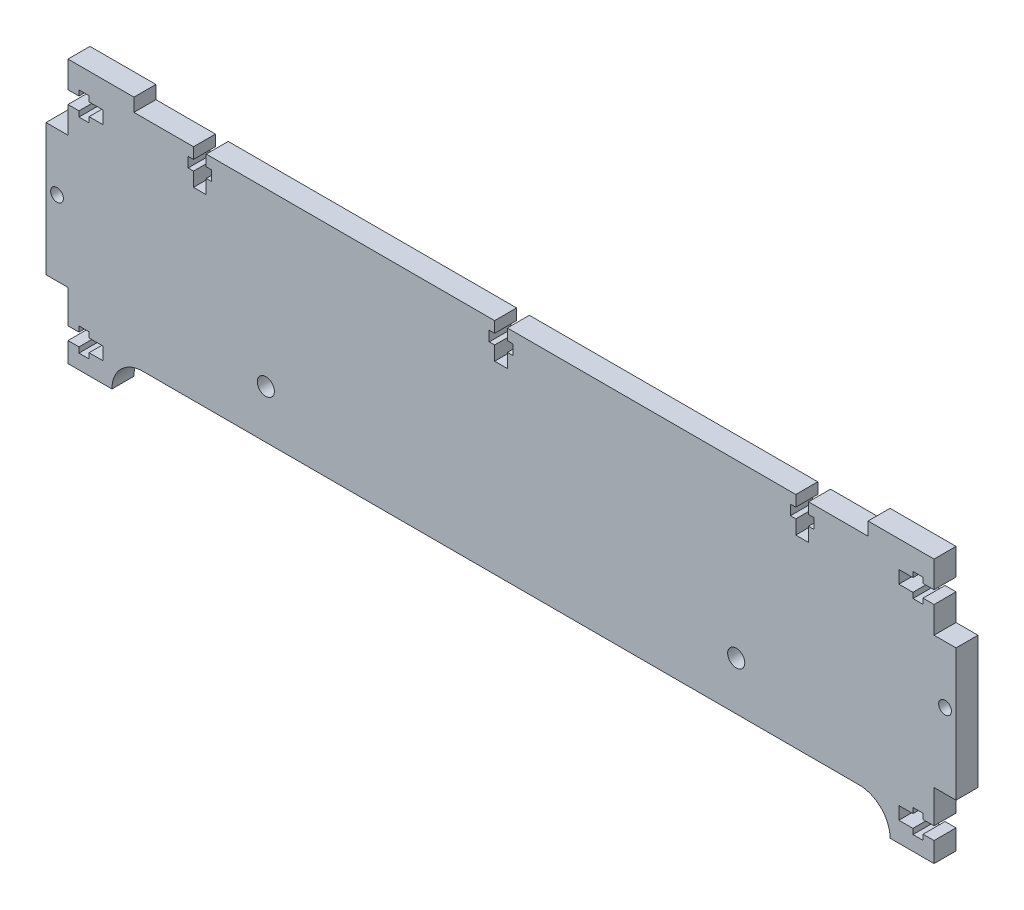
from build123d import *

# Parameters (mm, degrees)
SKETCH1_W           = 207
SKETCH1_H           = 60
BOSS_EXTRUDE1_DEPTH = 5
SKETCH2_W           = 5
SKETCH2_H           = 15
CUT_EXTRUDE1_DEPTH  = 116.491341667
SKETCH3_W           = 167
SKETCH3_H           = 3
CUT_EXTRUDE2_DEPTH  = 5
SKETCH4_R           = 1.45
SKETCH4_R_2         = 1.95
SKETCH4_W           = 8
SKETCH4_H           = 2.9
SKETCH4_W_2         = 2.3
SKETCH4_H_2         = 5.35
SKETCH4_W_3         = 5.35
SKETCH4_H_3         = 2.3
SKETCH4_W_4         = 2.9
SKETCH4_H_4         = 8
CUT_EXTRUDE3_DEPTH  = 116.491341667


with BuildPart() as part:
    # Sketch1 → Boss-Extrude1 (new body)
    with BuildSketch(Plane.XY):
        with Locations((0, 21)):
            Rectangle(SKETCH1_W, SKETCH1_H)
    extrude(amount=BOSS_EXTRUDE1_DEPTH)

    # Sketch2 → Cut-Extrude1 (cut, through all)
    with BuildSketch(Plane.XY.offset(5)):
        with Locations((-101, 43.5)):
            Rectangle(SKETCH2_W, SKETCH2_H)
        with Locations((-101, -1.5)):
            Rectangle(SKETCH2_W, SKETCH2_H)
        with Locations((101, 43.5)):
            Rectangle(SKETCH2_W, SKETCH2_H)
        with Locations((101, -1.5)):
            Rectangle(SKETCH2_W, SKETCH2_H)
    extrude(amount=-CUT_EXTRUDE1_DEPTH, mode=Mode.SUBTRACT)

    # Sketch3 → Cut-Extrude2 (cut)
    with BuildSketch(Plane.XY.offset(5)):
        with Locations((0, 49.5)):
            Rectangle(SKETCH3_W, SKETCH3_H)
        with BuildLine():
            ThreePointArc((-81.5, -2), (-76.550252532, -4.050252532), (-74.5, -9))
            Line((-74.5, -9), (74.5, -9))
            ThreePointArc((74.5, -9), (76.550252532, -4.050252532), (81.5, -2))
            Line((81.5, -2), (-81.5, -2))
        make_face()
        with BuildLine():
            Line((-81.5, -2), (-81.5, -9))
            Line((-81.5, -9), (-74.5, -9))
            ThreePointArc((-74.5, -9), (-76.550252532, -4.050252532), (-81.5, -2))
        make_face()
        with BuildLine():
            Line((-88.5, -9), (-81.5, -9))
            Line((-81.5, -9), (-81.5, -2))
            ThreePointArc((-81.5, -2), (-86.449747468, -4.050252532), (-88.5, -9))
        make_face()
        with BuildLine():
            ThreePointArc((81.5, -2), (76.550252532, -4.050252532), (74.5, -9))
            Line((74.5, -9), (81.5, -9))
            Line((81.5, -9), (81.5, -2))
        make_face()
        with BuildLine():
            ThreePointArc((88.5, -9), (86.449747468, -4.050252532), (81.5, -2))
            Line((81.5, -2), (81.5, -9))
            Line((81.5, -9), (88.5, -9))
        make_face()
    extrude(amount=-CUT_EXTRUDE2_DEPTH, mode=Mode.SUBTRACT)

    # Sketch4 → Cut-Extrude3 (cut, through all)
    with BuildSketch(Plane.XY.offset(5)):
        with Locations((101, 23)):
            Circle(SKETCH4_R)
        with Locations((-101, 23)):
            Circle(SKETCH4_R)
        with Locations((-53.5, 9)):
            Circle(SKETCH4_R_2)
        with Locations((53.5, 9)):
            Circle(SKETCH4_R_2)
        with Locations((94.5, 43.5)):
            Rectangle(SKETCH4_W, SKETCH4_H)
        with Locations((94.5, -3)):
            Rectangle(SKETCH4_W, SKETCH4_H)
        with Locations((94.85, 43.5)):
            Rectangle(SKETCH4_W_2, SKETCH4_H_2)
        with Locations((94.85, -3)):
            Rectangle(SKETCH4_W_2, SKETCH4_H_2)
        with Locations((-94.85, -3)):
            Rectangle(SKETCH4_W_2, SKETCH4_H_2)
        with Locations((68.5, 44.35)):
            Rectangle(SKETCH4_W_3, SKETCH4_H_3)
        with Locations((68.5, 44)):
            Rectangle(SKETCH4_W_4, SKETCH4_H_4)
        with Locations((-94.5, 43.5)):
            Rectangle(SKETCH4_W, SKETCH4_H)
        with Locations((-94.85, 43.5)):
            Rectangle(SKETCH4_W_2, SKETCH4_H_2)
        with Locations((-94.5, -3)):
            Rectangle(SKETCH4_W, SKETCH4_H)
        with Locations((0, 44.35)):
            Rectangle(SKETCH4_W_3, SKETCH4_H_3)
        with Locations((0, 44)):
            Rectangle(SKETCH4_W_4, SKETCH4_H_4)
        with Locations((-68.5, 44)):
            Rectangle(SKETCH4_W_4, SKETCH4_H_4)
        with Locations((-68.5, 44.35)):
            Rectangle(SKETCH4_W_3, SKETCH4_H_3)
    extrude(amount=-CUT_EXTRUDE3_DEPTH, mode=Mode.SUBTRACT)


solid = part.part
